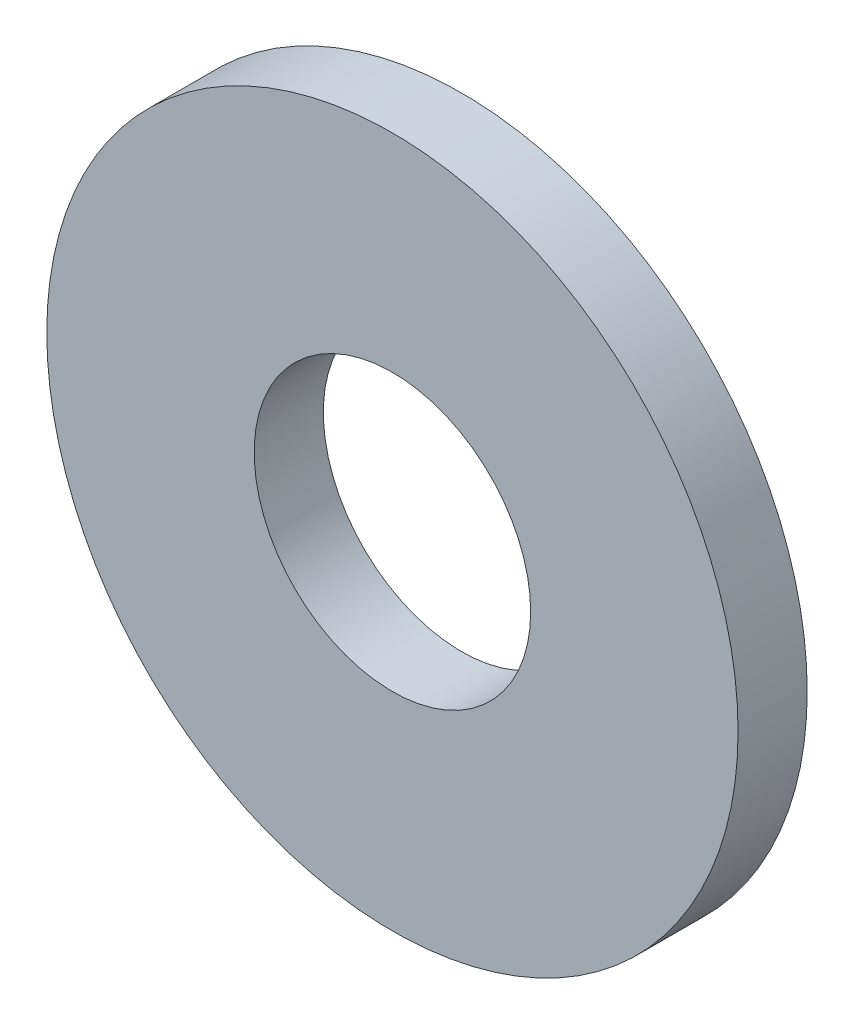
from build123d import *

# Parameters (mm, degrees)
SKETCH1_R           = 2.5
SKETCH1_R_2         = 1
BOSS_EXTRUDE1_DEPTH = 0.5


with BuildPart() as part:
    # Sketch1 → Boss-Extrude1 (new body)
    with BuildSketch(Plane.XY):
        Circle(SKETCH1_R)
        Circle(SKETCH1_R_2, mode=Mode.SUBTRACT)
    extrude(amount=BOSS_EXTRUDE1_DEPTH)


solid = part.part
